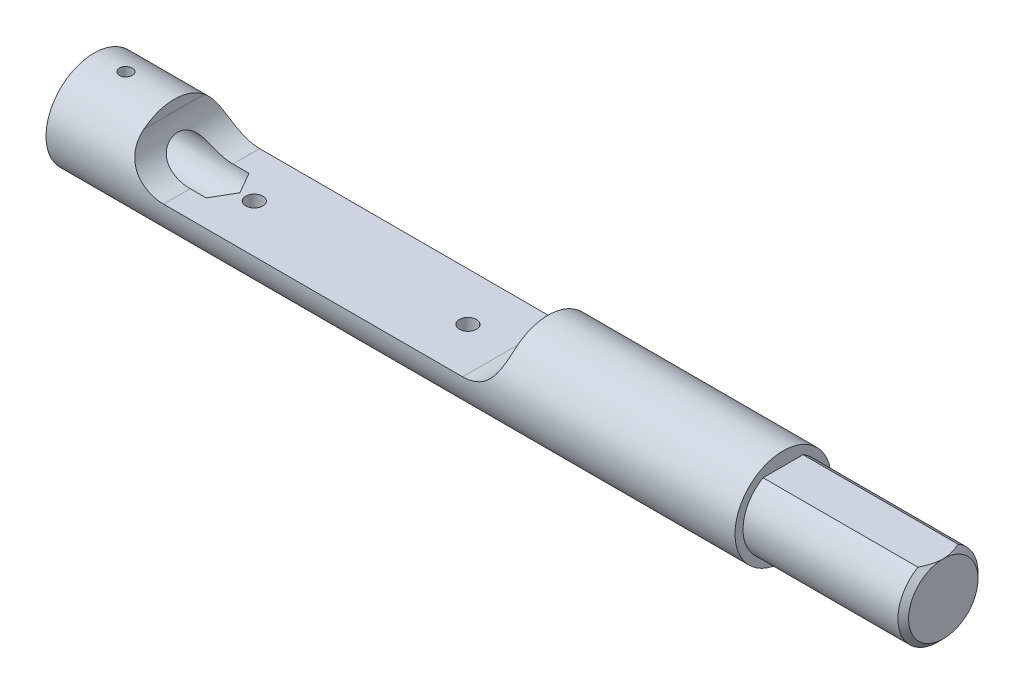
from build123d import *

# Parameters (mm, degrees)
CHANFREIN1_SIZE              = 1
ENL_V_MAT_EXTRU_1_DEPTH      = 160.508620457
ENL_V_MAT_EXTRU_1_DEPTH_BACK = 160.508620457
ESQUISSE3_W                  = 30
ESQUISSE3_H                  = 1
PER_AGE1_D                   = 8
PER_AGE1_DEPTH               = 25
PER_AGE1_TIP                 = 2.309401077
ESQUISSE6_R                  = 1.6
ENL_V_MAT_EXTRU_2_DEPTH      = 160.508620468
R_P_TITION_LIN_AIRE1_COUNT   = 2
R_P_TITION_LIN_AIRE1_PITCH   = 40
ESQUISSE7_R                  = 1.2
ENL_V_MAT_EXTRU_3_DEPTH      = 160.50862047


with BuildPart() as part:
    # Esquisse1 → Base-Révolution (revolve)
    with BuildSketch(Plane.XY, mode=Mode.PRIVATE) as base_r_volution_sk:
        Polygon((0, 0), (0, 9), (129, 9), (129, 7.5), (159, 7.5), (159, 0), align=None)
    revolve(base_r_volution_sk.sketch.rotate(Axis((0, 0, 0), (1, 0, 0)), 90), axis=Axis((0, 0, 0), (1, 0, 0)))

    # Chanfrein1
    chanfrein1_edges = [part.edges().sort_by_distance(p)[0] for p in [
        (159, 0, -7.5),
    ]]
    chamfer(chanfrein1_edges, length=CHANFREIN1_SIZE)

    # Esquisse3 → Enlèv. mat.-Extru.1 (cut, two sides: drawn at the far end of the back side and taken through both)
    with BuildSketch(Plane.XY.offset(-ENL_V_MAT_EXTRU_1_DEPTH_BACK)):
        with Locations((144, 7)):
            Rectangle(ESQUISSE3_W, ESQUISSE3_H)
        with BuildLine():
            Line((85, 9), (15, 9))
            Line((15, 9), (15, 7))
            ThreePointArc((15, 7), (17.050252532, 2.050252532), (22, 0))
            Line((22, 0), (78, 0))
            ThreePointArc((78, 0), (82.949747468, 2.050252532), (85, 7))
            Line((85, 7), (85, 9))
        make_face()
    extrude(amount=ENL_V_MAT_EXTRU_1_DEPTH + ENL_V_MAT_EXTRU_1_DEPTH_BACK, mode=Mode.SUBTRACT)

    # Perçage1
    with Locations(Plane.ZY):
        with Locations((0, 0)):
            Hole(PER_AGE1_D / 2, depth=PER_AGE1_DEPTH)
            with Locations((0, 0, -(PER_AGE1_DEPTH + PER_AGE1_TIP / 2))):  # 120° drill point
                Cone(0, PER_AGE1_D / 2, PER_AGE1_TIP, mode=Mode.SUBTRACT)

    # Esquisse6 → Enlèv. mat.-Extru.2 (cut, through all)
    with BuildSketch(Plane(origin=(0, 0, 0), x_dir=(-1, 0, 0), z_dir=(0, 1, 0))):
        with Locations(Location((-30, 0, 0), (0, 0, 90))):
            Circle(ESQUISSE6_R)
    enl_v_mat_extru_2 = extrude(amount=-ENL_V_MAT_EXTRU_2_DEPTH, mode=Mode.SUBTRACT)

    # Répétition linéaire1: Enlèv. mat.-Extru.2 ×2
    with Locations(*[(i * R_P_TITION_LIN_AIRE1_PITCH, 0, 0) for i in range(1, R_P_TITION_LIN_AIRE1_COUNT)]):
        add(enl_v_mat_extru_2, mode=Mode.SUBTRACT)

    # Esquisse7 → Enlèv. mat.-Extru.3 (cut, through all)
    with BuildSketch(Plane(origin=(0, 0, 0), x_dir=(-1, 0, 0), z_dir=(0, 1, 0))):
        with Locations(Location((-6, 0, 0), (0, 0, 270))):
            Circle(ESQUISSE7_R)
    extrude(amount=ENL_V_MAT_EXTRU_3_DEPTH, mode=Mode.SUBTRACT)


solid = part.part
